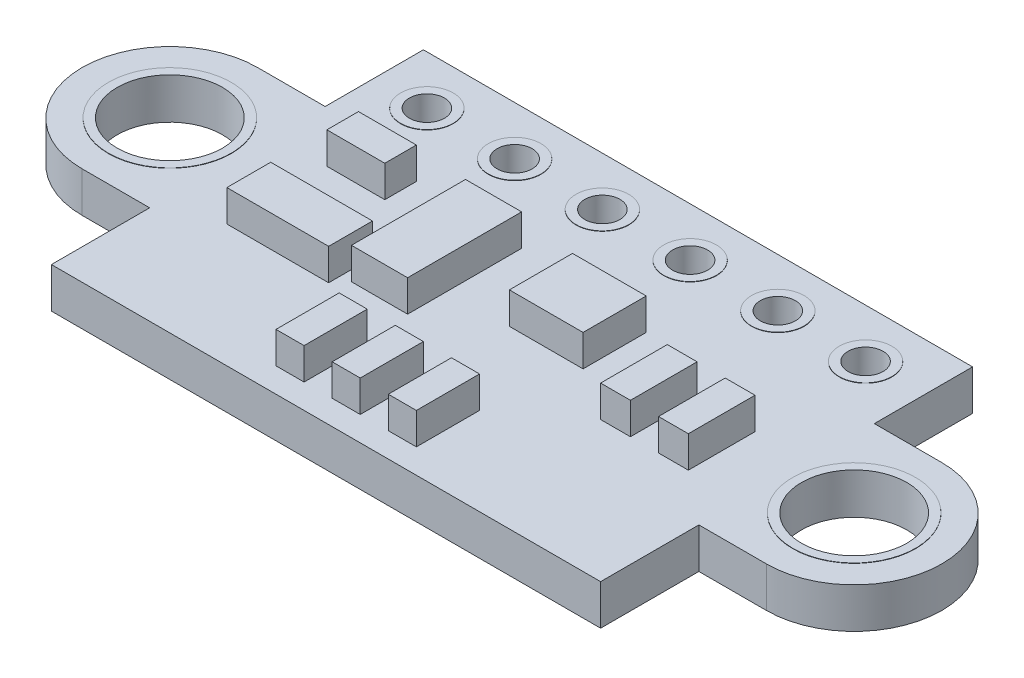
from build123d import *

# Parameters (mm, degrees)
SKETCH1_R               = 1.5
PCB_DEPTH               = 1.15
SKETCH2_R               = 0.5
INITIAL_HOLE_DEPTH      = 14.396828237
PIN_HOLE_LPATTERN_COUNT = 6
PIN_HOLE_LPATTERN_PITCH = 2.5
SKETCH4_W               = 4.4
SKETCH4_H               = 2.4
BOTTOM_COMPONENT_DEPTH  = 0.7
SKETCH3_W               = 0.8
SKETCH3_H               = 1.8
SKETCH3_W_2             = 1.65
SKETCH3_H_2             = 0.9
TAN_COMPONENTS_DEPTH    = 0.9
SKETCH3_3_W             = 2.1
SKETCH3_3_H             = 1.8
SKETCH3_3_W_2           = 1.6
SKETCH3_3_H_2           = 3.25
SKETCH3_3_W_3           = 2.9
SKETCH3_3_H_3           = 1.25
SKETCH3_3_W_4           = 0.85
SKETCH3_3_H_4           = 1.9
BLACK_COMPONENTS_DEPTH  = 0.9
GOLD_START              = -1.16
SKETCH5_R               = 0.75
SKETCH5_R_2             = 0.5
SKETCH5_R_3             = 1.75
SKETCH5_R_4             = 1.5
GOLD_CONTACTS_DEPTH     = 1.17
SILKSCREEN_DEPTH        = 0.01


with BuildPart() as part:
    # Sketch1 → PCB (new body)
    with BuildSketch(Plane(origin=(0, 0, 0), x_dir=(1, 0, 0), z_dir=(0, 1, 0))):
        with BuildLine():
            Line((-7.825, -5.299999814), (7.825, -5.299999814))
            Line((7.825, -5.299999814), (7.825, -2.499999814))
            Line((7.825, -2.499999814), (9.750000197, -2.499999814))
            ThreePointArc((9.750000197, -2.499999814), (12.250000197, 1.86e-07), (9.750000197, 2.500000186))
            Line((9.750000197, 2.500000186), (7.825, 2.500000186))
            Line((7.825, 2.500000186), (7.825, 5.300000186))
            Line((7.825, 5.300000186), (-7.825, 5.300000186))
            Line((-7.825, 5.300000186), (-7.825, 2.500000186))
            Line((-7.825, 2.500000186), (-9.750000197, 2.5))
            ThreePointArc((-9.750000197, 2.5), (-12.249999803, 0), (-9.750000197, -2.5))
            Line((-9.750000197, -2.5), (-7.825, -2.499999814))
            Line((-7.825, -2.499999814), (-7.825, -5.299999814))
        make_face()
        with Locations(Location((-9.749999803, 0, 0), (0, 0, 270))):
            Circle(SKETCH1_R, mode=Mode.SUBTRACT)
        with Locations(Location((9.750000197, 1.86e-07, 0), (0, 0, 270))):
            Circle(SKETCH1_R, mode=Mode.SUBTRACT)
    extrude(amount=PCB_DEPTH)

    # Sketch2 → Initial Hole (cut, through all)
    with BuildSketch(Plane(origin=(0, 1.15, 0), x_dir=(1, 0, 0), z_dir=(0, 1, 0))):
        with Locations(Location((-6.325, 3.900000186, 0), (0, 0, 270))):
            Circle(SKETCH2_R)
    initial_hole = extrude(amount=-INITIAL_HOLE_DEPTH, mode=Mode.SUBTRACT)

    # Pin Hole LPattern: Initial Hole ×6
    with Locations(*[(i * PIN_HOLE_LPATTERN_PITCH, 0, 0) for i in range(1, PIN_HOLE_LPATTERN_COUNT)]):
        add(initial_hole, mode=Mode.SUBTRACT)

    # Sketch4 → Bottom Component (add)
    with BuildSketch(Plane.XZ):
        with Locations((-0.125, 2.499999814)):
            Rectangle(SKETCH4_W, SKETCH4_H)
    extrude(amount=BOTTOM_COMPONENT_DEPTH)

    # Sketch3 → Tan Components (add)
    with BuildSketch(Plane(origin=(0, 1.15, 0), x_dir=(1, 0, 0), z_dir=(0, 1, 0))):
        with Locations((-1.725, -3.699999814)):
            Rectangle(SKETCH3_W, SKETCH3_H)
        with Locations((-0.125, -3.699999814)):
            Rectangle(SKETCH3_W, SKETCH3_H)
        with Locations((1.475, -3.699999814)):
            Rectangle(SKETCH3_W, SKETCH3_H)
        with Locations((-5.5, 1.500000186)):
            Rectangle(SKETCH3_W_2, SKETCH3_H_2)
    extrude(amount=TAN_COMPONENTS_DEPTH)

    # Sketch3<3> → Black Components (add)
    with BuildSketch(Plane(origin=(0, 1.15, 0), x_dir=(1, 0, 0), z_dir=(0, 1, 0))):
        with Locations((1.275, 0.600000186)):
            Rectangle(SKETCH3_3_W, SKETCH3_3_H)
        with Locations((-2.325, 0.175000186)):
            Rectangle(SKETCH3_3_W_2, SKETCH3_3_H_2)
        with Locations((-4.875, -1.174999814)):
            Rectangle(SKETCH3_3_W_3, SKETCH3_3_H_3)
        with Locations((4.25, -0.349999814)):
            Rectangle(SKETCH3_3_W_4, SKETCH3_3_H_4)
        with Locations((5.9, -0.349999814)):
            Rectangle(SKETCH3_3_W_4, SKETCH3_3_H_4)
    extrude(amount=BLACK_COMPONENTS_DEPTH)

    # Sketch5 → Gold Contacts (add)
    # profile 1 of 8: a face of its own
    with BuildSketch(Plane(origin=(0, 1.15, 0), x_dir=(1, 0, 0), z_dir=(0, 1, 0)).offset(GOLD_START)):
        with Locations(Location((-6.325, 3.9, 0), (0, 0, 90))):
            Circle(SKETCH5_R)
        with Locations(Location((-6.325, 3.9, 0), (0, 0, 270))):
            Circle(SKETCH5_R_2, mode=Mode.SUBTRACT)
    # profile 2 of 8: a face of its own
    with BuildSketch(Plane(origin=(0, 1.15, 0), x_dir=(1, 0, 0), z_dir=(0, 1, 0)).offset(GOLD_START)):
        with Locations(Location((-3.825, 3.9, 0), (0, 0, 90))):
            Circle(SKETCH5_R)
        with Locations(Location((-3.825, 3.9, 0), (0, 0, 270))):
            Circle(SKETCH5_R_2, mode=Mode.SUBTRACT)
    # profile 3 of 8: a face of its own
    with BuildSketch(Plane(origin=(0, 1.15, 0), x_dir=(1, 0, 0), z_dir=(0, 1, 0)).offset(GOLD_START)):
        with Locations(Location((-1.325, 3.9, 0), (0, 0, 90))):
            Circle(SKETCH5_R)
        with Locations(Location((-1.325, 3.9, 0), (0, 0, 270))):
            Circle(SKETCH5_R_2, mode=Mode.SUBTRACT)
    # profile 4 of 8: a face of its own
    with BuildSketch(Plane(origin=(0, 1.15, 0), x_dir=(1, 0, 0), z_dir=(0, 1, 0)).offset(GOLD_START)):
        with Locations(Location((1.175, 3.9, 0), (0, 0, 90))):
            Circle(SKETCH5_R)
        with Locations(Location((1.175, 3.9, 0), (0, 0, 270))):
            Circle(SKETCH5_R_2, mode=Mode.SUBTRACT)
    # profile 5 of 8: a face of its own
    with BuildSketch(Plane(origin=(0, 1.15, 0), x_dir=(1, 0, 0), z_dir=(0, 1, 0)).offset(GOLD_START)):
        with Locations(Location((3.675, 3.9, 0), (0, 0, 90))):
            Circle(SKETCH5_R)
        with Locations(Location((3.675, 3.9, 0), (0, 0, 270))):
            Circle(SKETCH5_R_2, mode=Mode.SUBTRACT)
    # profile 6 of 8: a face of its own
    with BuildSketch(Plane(origin=(0, 1.15, 0), x_dir=(1, 0, 0), z_dir=(0, 1, 0)).offset(GOLD_START)):
        with Locations(Location((6.175, 3.9, 0), (0, 0, 90))):
            Circle(SKETCH5_R)
        with Locations(Location((6.175, 3.9, 0), (0, 0, 270))):
            Circle(SKETCH5_R_2, mode=Mode.SUBTRACT)
    # profile 7 of 8: a face of its own
    with BuildSketch(Plane(origin=(0, 1.15, 0), x_dir=(1, 0, 0), z_dir=(0, 1, 0)).offset(GOLD_START)):
        with Locations(Location((-9.749999803, 0, 0), (0, 0, 90))):
            Circle(SKETCH5_R_3)
        with Locations(Location((-9.749999803, 0, 0), (0, 0, 90))):
            Circle(SKETCH5_R_4, mode=Mode.SUBTRACT)
    # profile 8 of 8: a face of its own
    with BuildSketch(Plane(origin=(0, 1.15, 0), x_dir=(1, 0, 0), z_dir=(0, 1, 0)).offset(GOLD_START)):
        with Locations(Location((9.750000197, 1.86e-07, 0), (0, 0, 90))):
            Circle(SKETCH5_R_3)
        with Locations(Location((9.750000197, 1.86e-07, 0), (0, 0, 90))):
            Circle(SKETCH5_R_4, mode=Mode.SUBTRACT)
    extrude(amount=GOLD_CONTACTS_DEPTH)

    # Sketch6 → Silkscreen (add)
    # profile 1 of 22: a face of its own
    with BuildSketch(Plane.XZ):
        Polygon((-6.825, -1.952173913), (-5.825, -2.287771739), (-5.825, -2.471195652), (-6.825, -2.807246377), (-6.825, -2.653713768), (-6.151086957, -2.43451087), (-5.953623188, -2.372463768), (-6.151086957, -2.310643116), (-6.825, -2.097327899), align=None)
    # profile 2 of 22: a face of its own
    with BuildSketch(Plane.XZ):
        Polygon((-6.709057971, -1.582608696), (-6.709057971, -1.814492754), (-6.825, -1.814492754), (-6.825, -1.205797101), (-6.709057971, -1.205797101), (-6.709057971, -1.437681159), (-5.940942029, -1.437681159), (-5.940942029, -1.205797101), (-5.825, -1.205797101), (-5.825, -1.814492754), (-5.940942029, -1.814492754), (-5.940942029, -1.582608696), align=None)
    # profile 3 of 22: a face of its own
    with BuildSketch(Plane.XZ):
        Polygon((-5.825, -0.32173913), (-5.825, -0.513088768), (-6.450226449, -0.780751812), (-6.651086957, -0.857971014), (-6.145652174, -0.857971014), (-5.825, -0.857971014), (-5.825, -1.002898551), (-6.825, -1.002898551), (-6.825, -0.813813406), (-6.229438406, -0.558831522), (-5.998913043, -0.466666667), (-6.538768116, -0.466666667), (-6.825, -0.466666667), (-6.825, -0.32173913), align=None)
    # profile 4 of 22: a face of its own
    with BuildSketch(Plane.XZ):
        with BuildLine():
            add(Edge.make_bspline(
                [(-4.16557971, -2.017391304), (-4.174136808, -2.036630775), (-4.191199813, -2.074994622), (-4.206514485, -2.125407709), (-4.215359186, -2.166891843), (-4.220047282, -2.199419822), (-4.223108769, -2.233289439), (-4.22340197, -2.25636393), (-4.223550725, -2.268070652)],
                knots=[0, 0, 0, 0, 1.45945927, 2.910187841, 3.643322816, 4.400006487, 5.188251666, 6, 6, 6, 6], degree=3))
            add(Edge.make_bspline(
                [(-4.223550725, -2.268070652), (-4.22322949, -2.281377316), (-4.222602438, -2.307351996), (-4.216940861, -2.345108655), (-4.208337016, -2.380758222), (-4.195489198, -2.413866615), (-4.17961186, -2.44462082), (-4.160629453, -2.472899107), (-4.138904749, -2.498868644), (-4.113944215, -2.522077592), (-4.086253856, -2.542779138), (-4.055632763, -2.560551871), (-4.022719242, -2.576378917), (-3.987082881, -2.589094015), (-3.949265216, -2.599443979), (-3.909263191, -2.606099476), (-3.867467195, -2.611013366), (-3.838904478, -2.611397876), (-3.824320652, -2.611594203)],
                knots=[0, 0, 0, 0, 1.073506903, 2.095491357, 3.07528147, 4.02808022, 4.954664346, 5.863855779, 6.771964439, 7.68156413, 8.60894928, 9.556766833, 10.535210833, 11.552936014, 12.60679191, 13.695699548, 14.823448183, 16, 16, 16, 16], degree=3))
            add(Edge.make_bspline(
                [(-3.824320652, -2.611594203), (-3.809143177, -2.611380344), (-3.779578644, -2.610963765), (-3.736449664, -2.607633153), (-3.695878247, -2.601633568), (-3.657629955, -2.593961819), (-3.622081106, -2.583343084), (-3.589249985, -2.570170376), (-3.55912608, -2.554625403), (-3.531963675, -2.536090261), (-3.507539876, -2.515047996), (-3.486319521, -2.490985639), (-3.468092374, -2.464275607), (-3.452820225, -2.434812166), (-3.44069766, -2.402464295), (-3.432593727, -2.36704555), (-3.427130416, -2.328777955), (-3.426681667, -2.302209832), (-3.426449275, -2.288451087)],
                knots=[0, 0, 0, 0, 1.243083075, 2.421428388, 3.539723701, 4.600698439, 5.613925084, 6.573719655, 7.494592113, 8.384583086, 9.261071518, 10.128265192, 11.004557353, 11.903267233, 12.840351451, 13.825576228, 14.873938418, 16, 16, 16, 16], degree=3))
            add(Edge.make_bspline(
                [(-3.426449275, -2.288451087), (-3.426557797, -2.283391816), (-3.426783167, -2.272885048), (-3.427977385, -2.256723311), (-3.429688391, -2.240016095), (-3.432332267, -2.223210614), (-3.434998211, -2.206580775), (-3.439049004, -2.190736952), (-3.442817527, -2.175890096), (-3.446156732, -2.1666755), (-3.447735507, -2.162318841)],
                knots=[0, 0, 0, 0, 0.945174182, 1.962876632, 3.026435683, 4.081359978, 5.140798144, 6.170252855, 7.134895744, 8, 8, 8, 8], degree=3))
            Line((-3.447735507, -2.162318841), (-3.774275362, -2.162318841))
            Line((-3.774275362, -2.162318841), (-3.774275362, -2.363405797))
            Line((-3.774275362, -2.363405797), (-3.890217391, -2.363405797))
            Line((-3.890217391, -2.363405797), (-3.890217391, -2.017391304))
            Line((-3.890217391, -2.017391304), (-3.371875, -2.017391304))
            add(Edge.make_bspline(
                [(-3.371875, -2.017391304), (-3.367030046, -2.028271125), (-3.357200328, -2.050344726), (-3.345363234, -2.08510047), (-3.334241057, -2.120769039), (-3.325959411, -2.157567213), (-3.31869163, -2.19443818), (-3.31419718, -2.231229109), (-3.310988457, -2.267183443), (-3.310665771, -2.290859659), (-3.310507246, -2.302490942)],
                knots=[0, 0, 0, 0, 0.972500234, 1.973063936, 2.997292887, 4.023432248, 5.052698482, 6.066196364, 7.049990992, 8, 8, 8, 8], degree=3))
            add(Edge.make_bspline(
                [(-3.310507246, -2.302490942), (-3.310905816, -2.319565756), (-3.311684267, -2.35291475), (-3.317554741, -2.401697579), (-3.327799519, -2.447761658), (-3.341765997, -2.491305823), (-3.359867574, -2.531840385), (-3.381832828, -2.569470393), (-3.407650288, -2.603973416), (-3.437529203, -2.635228568), (-3.471387186, -2.662948247), (-3.508911649, -2.687650368), (-3.550729527, -2.708302897), (-3.596038452, -2.726063283), (-3.645257849, -2.739888456), (-3.698190574, -2.749395276), (-3.754813701, -2.755404218), (-3.793809632, -2.756141713), (-3.813903986, -2.756521739)],
                knots=[0, 0, 0, 0, 1.063581333, 2.077291621, 3.055048503, 3.999338437, 4.921305722, 5.814907333, 6.708360461, 7.599707407, 8.501634143, 9.428958272, 10.392121034, 11.401590661, 12.45703254, 13.571190175, 14.748449862, 16, 16, 16, 16], degree=3))
            add(Edge.make_bspline(
                [(-3.813903986, -2.756521739), (-3.833924869, -2.756086904), (-3.873021503, -2.75523776), (-3.930089405, -2.748620154), (-3.983972025, -2.737560692), (-4.034559078, -2.722216618), (-4.081689195, -2.702747531), (-4.124974269, -2.679239878), (-4.165055349, -2.652836335), (-4.200910799, -2.622257515), (-4.232998202, -2.588436343), (-4.261036494, -2.551292568), (-4.284869344, -2.510889075), (-4.304888067, -2.467540256), (-4.320451722, -2.421293126), (-4.331540229, -2.372516514), (-4.338177251, -2.321469625), (-4.339049616, -2.286659206), (-4.339492754, -2.268976449)],
                knots=[0, 0, 0, 0, 1.187439749, 2.318823544, 3.40248674, 4.446409754, 5.450107936, 6.421783, 7.364382464, 8.292037633, 9.210592067, 10.124945974, 11.046464198, 11.988116631, 12.952407463, 13.935437336, 14.951257712, 16, 16, 16, 16], degree=3))
            add(Edge.make_bspline(
                [(-4.339492754, -2.268976449), (-4.338967559, -2.246458731), (-4.337940426, -2.202420402), (-4.331256424, -2.14819149), (-4.323600483, -2.106385649), (-4.315620928, -2.076129681), (-4.307099293, -2.0462542), (-4.299706484, -2.027004609), (-4.296014493, -2.017391304)],
                knots=[0, 0, 0, 0, 1.577988587, 3.086102288, 3.823904134, 4.555361188, 5.278542922, 6, 6, 6, 6], degree=3))
            Line((-4.296014493, -2.017391304), (-4.16557971, -2.017391304))
        make_face()
    # profile 5 of 22: a face of its own
    with BuildSketch(Plane.XZ):
        Polygon((-3.325, -1.176811594), (-3.325, -1.368161232), (-3.950226449, -1.635824275), (-4.151086957, -1.713043478), (-3.645652174, -1.713043478), (-3.325, -1.713043478), (-3.325, -1.857971014), (-4.325, -1.857971014), (-4.325, -1.66888587), (-3.729438406, -1.413903986), (-3.498913043, -1.32173913), (-4.038768116, -1.32173913), (-4.325, -1.32173913), (-4.325, -1.176811594), align=None)
    # profile 6 of 22: a face of its own
    with BuildSketch(Plane.XZ):
        with BuildLine():
            add(Edge.make_bspline(
                [(-3.836096014, -0.27826087), (-3.812594171, -0.278737134), (-3.766491769, -0.279671398), (-3.709766433, -0.286970746), (-3.666180263, -0.295280938), (-3.634972547, -0.303483854), (-3.604849033, -0.313234061), (-3.575958638, -0.324751193), (-3.548183732, -0.337951756), (-3.52159763, -0.352747386), (-3.496713015, -0.369994169), (-3.472761853, -0.388505681), (-3.450235426, -0.409094524), (-3.429589218, -0.432168545), (-3.410505814, -0.457341518), (-3.393246465, -0.48485945), (-3.377997913, -0.514659864), (-3.363881117, -0.546402566), (-3.352650459, -0.580813238), (-3.342514641, -0.617323563), (-3.33463535, -0.656364207), (-3.329042087, -0.697964541), (-3.325608517, -0.742121998), (-3.325206339, -0.772442291), (-3.325, -0.787998188)],
                knots=[0, 0, 0, 0, 1.874778086, 3.677659276, 4.555411841, 5.414508245, 6.25076779, 7.080755626, 7.894473888, 8.703653385, 9.505626019, 10.308141413, 11.118150068, 11.937068997, 12.775581797, 13.636302782, 14.525391725, 15.445290438, 16.405354875, 17.410742648, 18.46805968, 19.580643525, 20.758743499, 22, 22, 22, 22], degree=3))
            Line((-3.325, -0.787998188), (-3.325, -1.002898551))
            Line((-3.325, -1.002898551), (-4.325, -1.002898551))
            Line((-4.325, -1.002898551), (-4.325, -0.744293478))
            add(Edge.make_bspline(
                [(-4.325, -0.744293478), (-4.324688368, -0.725333018), (-4.324083472, -0.688529625), (-4.318395518, -0.635197923), (-4.30890193, -0.585590009), (-4.295955445, -0.539604937), (-4.278839084, -0.497440889), (-4.258296007, -0.45883863), (-4.233600376, -0.424093617), (-4.205072566, -0.393057329), (-4.172712538, -0.365663685), (-4.136222346, -0.342239325), (-4.095907101, -0.322258215), (-4.051566132, -0.305974266), (-4.003189722, -0.293682427), (-3.951029965, -0.284699007), (-3.894863296, -0.279213265), (-3.856111855, -0.278585251), (-3.836096014, -0.27826087)],
                knots=[0, 0, 0, 0, 1.17177347, 2.274482801, 3.310388109, 4.291013938, 5.222472681, 6.118087065, 6.988127256, 7.850034114, 8.717518086, 9.601485366, 10.523818561, 11.493740021, 12.515690363, 13.604990885, 14.762933224, 16, 16, 16, 16], degree=3))
        make_face()
        with BuildLine():
            add(Edge.make_bspline(
                [(-3.824547101, -0.423188406), (-3.841612899, -0.423371822), (-3.874427817, -0.423724502), (-3.921550288, -0.427329088), (-3.964611557, -0.43335622), (-4.003740235, -0.441819199), (-4.039012488, -0.452994776), (-4.070937402, -0.466111822), (-4.09887287, -0.482673258), (-4.123789391, -0.50122703), (-4.144883235, -0.522800987), (-4.163203552, -0.546604149), (-4.177741542, -0.573323206), (-4.18966826, -0.60231497), (-4.198346963, -0.633909563), (-4.204715068, -0.667986445), (-4.208204125, -0.704743636), (-4.208767587, -0.730095831), (-4.209057971, -0.743161232)],
                knots=[0, 0, 0, 0, 1.413273786, 2.717509377, 3.911113665, 5.012370192, 6.028682814, 6.972739505, 7.863782455, 8.711554031, 9.53824734, 10.354760011, 11.191533455, 12.049501983, 12.946054968, 13.900037449, 14.917772052, 16, 16, 16, 16], degree=3))
            Line((-4.209057971, -0.743161232), (-4.209057971, -0.857971014))
            Line((-4.209057971, -0.857971014), (-3.440942029, -0.857971014))
            Line((-3.440942029, -0.857971014), (-3.440942029, -0.758106884))
            add(Edge.make_bspline(
                [(-3.440942029, -0.758106884), (-3.441280588, -0.744586824), (-3.441938681, -0.718306405), (-3.446036804, -0.68011771), (-3.453866258, -0.644687488), (-3.464227658, -0.611790195), (-3.47752298, -0.581425169), (-3.494259025, -0.553832382), (-3.513777188, -0.528726818), (-3.536487171, -0.5063141), (-3.562196806, -0.486545875), (-3.591014635, -0.469554942), (-3.622633627, -0.455009878), (-3.657253549, -0.443271608), (-3.694873433, -0.434308497), (-3.735437992, -0.427783479), (-3.779033431, -0.423973079), (-3.809065455, -0.423455315), (-3.824547101, -0.423188406)],
                knots=[0, 0, 0, 0, 1.112368836, 2.162232858, 3.153671654, 4.092370021, 4.995862172, 5.873374016, 6.740409183, 7.605418486, 8.490978658, 9.401506614, 10.351738463, 11.349303293, 12.403565438, 13.529577563, 14.726485918, 16, 16, 16, 16], degree=3))
        make_face(mode=Mode.SUBTRACT)
    # profile 7 of 22: a face of its own
    with BuildSketch(Plane.XZ):
        with BuildLine():
            add(Edge.make_bspline(
                [(-1.095606884, -2.031884058), (-1.084037243, -2.032217236), (-1.061517869, -2.032865741), (-1.02883408, -2.038329271), (-0.998514455, -2.04769559), (-0.970339585, -2.060464718), (-0.944570102, -2.076602975), (-0.920890583, -2.095645384), (-0.899597744, -2.117634909), (-0.880775705, -2.142642667), (-0.863875018, -2.170070441), (-0.84972659, -2.200494312), (-0.837484548, -2.233341893), (-0.827584942, -2.268731992), (-0.82003006, -2.306373014), (-0.814277248, -2.345969656), (-0.811208625, -2.387511393), (-0.810744152, -2.415786545), (-0.810507246, -2.430208333)],
                knots=[0, 0, 0, 0, 1.005542668, 1.957207907, 2.870649987, 3.757654935, 4.639106304, 5.50728757, 6.393806754, 7.292990278, 8.223879093, 9.189763998, 10.205281347, 11.269088171, 12.381198635, 13.541420952, 14.745997712, 16, 16, 16, 16], degree=3))
            add(Edge.make_bspline(
                [(-0.810507246, -2.430208333), (-0.810622933, -2.443496977), (-0.810853786, -2.470014301), (-0.813166181, -2.509408285), (-0.815673861, -2.548009533), (-0.819456641, -2.585126407), (-0.823303967, -2.620585883), (-0.828456035, -2.653751594), (-0.833398889, -2.684469288), (-0.837531778, -2.703848445), (-0.839492754, -2.713043478)],
                knots=[0, 0, 0, 0, 1.119774364, 2.234495903, 3.324975685, 4.379535058, 5.378502437, 6.330339078, 7.20777842, 8, 8, 8, 8], degree=3))
            Line((-0.839492754, -2.713043478), (-0.969927536, -2.713043478))
            add(Edge.make_bspline(
                [(-0.969927536, -2.713043478), (-0.966552908, -2.703194299), (-0.959657693, -2.683069944), (-0.951570232, -2.651503019), (-0.943974855, -2.618390348), (-0.937629391, -2.583417285), (-0.9326352, -2.546243106), (-0.929122846, -2.50672598), (-0.926744308, -2.464733157), (-0.926549451, -2.435948546), (-0.926449275, -2.421150362)],
                knots=[0, 0, 0, 0, 0.842364813, 1.72116351, 2.635659137, 3.591954833, 4.596841017, 5.670471508, 6.802388115, 8, 8, 8, 8], degree=3))
            add(Edge.make_bspline(
                [(-0.926449275, -2.421150362), (-0.92655811, -2.410577772), (-0.92676745, -2.390241856), (-0.928956044, -2.360938837), (-0.931809416, -2.334030456), (-0.936765492, -2.309574695), (-0.942469956, -2.28732606), (-0.949729155, -2.267216224), (-0.958367794, -2.249276352), (-0.968052863, -2.233195397), (-0.97924044, -2.219408765), (-0.991306366, -2.207338701), (-1.004787784, -2.197552637), (-1.019410561, -2.189872313), (-1.03498124, -2.183872496), (-1.051666285, -2.179898308), (-1.069411035, -2.177339563), (-1.08163324, -2.176990691), (-1.087907609, -2.176811594)],
                knots=[0, 0, 0, 0, 1.523249472, 2.929903915, 4.233296251, 5.419431577, 6.522341058, 7.540917397, 8.494515215, 9.388156094, 10.239274487, 11.04695073, 11.841108735, 12.62943441, 13.421354294, 14.239221521, 15.096090076, 16, 16, 16, 16], degree=3))
            add(Edge.make_bspline(
                [(-1.087907609, -2.176811594), (-1.094426537, -2.17703645), (-1.107163151, -2.177475772), (-1.125435736, -2.181963136), (-1.142380665, -2.188979105), (-1.15749305, -2.199264852), (-1.171692263, -2.211352456), (-1.184703873, -2.225552355), (-1.197283356, -2.241228157), (-1.213115965, -2.265007733), (-1.231630292, -2.298354985), (-1.250637426, -2.342511497), (-1.26886559, -2.38970772), (-1.288476693, -2.437864455), (-1.309006891, -2.486204671), (-1.331340416, -2.533292462), (-1.355979832, -2.578017492), (-1.381319557, -2.61105989), (-1.403463962, -2.634677033), (-1.421459789, -2.650462776), (-1.44109508, -2.664186822), (-1.461836158, -2.676643308), (-1.484550157, -2.686519849), (-1.509153672, -2.693424444), (-1.53573621, -2.697919666), (-1.554147254, -2.698335482), (-1.563677536, -2.698550725)],
                knots=[0, 0, 0, 0, 0.619856703, 1.211069627, 1.781317632, 2.357652662, 2.944124569, 3.554568585, 4.189016027, 4.857081954, 6.273378886, 7.815244584, 9.432151164, 11.09313998, 12.767999346, 14.433898664, 16.057028127, 17.6216601, 18.384562662, 19.138741378, 19.896851429, 20.66387654, 21.439947467, 22.247841025, 23.093013471, 24, 24, 24, 24], degree=3))
            add(Edge.make_bspline(
                [(-1.563677536, -2.698550725), (-1.572223552, -2.698290907), (-1.589336579, -2.697770634), (-1.614907555, -2.693472972), (-1.640254816, -2.686713531), (-1.665287559, -2.677198511), (-1.689421117, -2.664730656), (-1.712573795, -2.649573358), (-1.733868511, -2.630857975), (-1.7541838, -2.60963982), (-1.772586237, -2.58489951), (-1.789061309, -2.557014122), (-1.803511537, -2.525836375), (-1.816546422, -2.491668648), (-1.82691831, -2.453932463), (-1.83434214, -2.412792808), (-1.838533807, -2.368248169), (-1.839165775, -2.337448397), (-1.839492754, -2.321512681)],
                knots=[0, 0, 0, 0, 0.784008501, 1.569943279, 2.373275585, 3.189059721, 4.022597455, 4.862331727, 5.722035901, 6.618905113, 7.554234865, 8.545209567, 9.586587379, 10.704826919, 11.898277364, 13.172984207, 14.537309982, 16, 16, 16, 16], degree=3))
            add(Edge.make_bspline(
                [(-1.839492754, -2.321512681), (-1.839317368, -2.312604062), (-1.838952995, -2.2940959), (-1.837368927, -2.265541429), (-1.834647801, -2.235792618), (-1.830979071, -2.205529197), (-1.826738506, -2.175318782), (-1.821753302, -2.14565927), (-1.816429126, -2.117187582), (-1.812435233, -2.098753719), (-1.810507246, -2.089855072)],
                knots=[0, 0, 0, 0, 0.914358742, 1.899632051, 2.934074914, 3.979452354, 5.027838988, 6.06445484, 7.065647236, 8, 8, 8, 8], degree=3))
            Line((-1.810507246, -2.089855072), (-1.694565217, -2.089855072))
            add(Edge.make_bspline(
                [(-1.694565217, -2.089855072), (-1.698925606, -2.109666509), (-1.707605604, -2.149104107), (-1.716805547, -2.208363865), (-1.722438512, -2.266677422), (-1.723184374, -2.30512101), (-1.723550725, -2.324003623)],
                knots=[0, 0, 0, 0, 1.029354975, 2.049083439, 3.041754323, 4, 4, 4, 4], degree=3))
            add(Edge.make_bspline(
                [(-1.723550725, -2.324003623), (-1.723405312, -2.333516863), (-1.723123445, -2.351957249), (-1.721390441, -2.37865386), (-1.718216986, -2.403372901), (-1.7139249, -2.426139484), (-1.70861338, -2.447016528), (-1.701865324, -2.465939781), (-1.693628433, -2.482804989), (-1.684373765, -2.497895917), (-1.673896999, -2.510991), (-1.662774558, -2.522502654), (-1.650680114, -2.532113634), (-1.637615824, -2.539871733), (-1.623755385, -2.545943065), (-1.609156755, -2.550658199), (-1.593572125, -2.553051309), (-1.582932509, -2.553429675), (-1.577490942, -2.553623188)],
                knots=[0, 0, 0, 0, 1.491437277, 2.890989782, 4.191431573, 5.395946596, 6.521058188, 7.565423013, 8.539223212, 9.458660202, 10.334655275, 11.163081303, 11.963306063, 12.748694206, 13.538083787, 14.331542868, 15.146677777, 16, 16, 16, 16], degree=3))
            add(Edge.make_bspline(
                [(-1.577490942, -2.553623188), (-1.570971784, -2.553399859), (-1.55823472, -2.552963522), (-1.5398974, -2.548438055), (-1.522919275, -2.541474541), (-1.507500113, -2.531386016), (-1.493419772, -2.519066768), (-1.479923473, -2.505133221), (-1.467231268, -2.489422296), (-1.451018729, -2.465673216), (-1.432444857, -2.432169319), (-1.413455089, -2.387874166), (-1.394889723, -2.340779741), (-1.375339262, -2.292569889), (-1.354853968, -2.244174305), (-1.335835518, -2.204717583), (-1.319501928, -2.17409803), (-1.30581027, -2.15264009), (-1.291370605, -2.132264668), (-1.275414854, -2.113533564), (-1.258550452, -2.095940414), (-1.240018277, -2.080309313), (-1.220378755, -2.066150977), (-1.199065245, -2.054076214), (-1.176151406, -2.043837011), (-1.151019267, -2.037035783), (-1.124001456, -2.032509701), (-1.10528886, -2.03209739), (-1.095606884, -2.031884058)],
                knots=[0, 0, 0, 0, 0.667490157, 1.304135379, 1.925338702, 2.541746512, 3.184203398, 3.84128389, 4.529338779, 5.253104542, 6.788775438, 8.449127214, 10.193159048, 11.981788067, 13.78535353, 15.582625783, 16.473069092, 17.343045967, 18.191816017, 19.032495598, 19.864754018, 20.688614347, 21.515778917, 22.344572585, 23.197569954, 24.082441501, 25.007847132, 26, 26, 26, 26], degree=3))
        make_face()
    # profile 8 of 22: a face of its own
    with BuildSketch(Plane.XZ):
        with BuildLine():
            add(Edge.make_bspline(
                [(-0.853985507, -1.191304348), (-0.847265054, -1.211198667), (-0.833858192, -1.250886523), (-0.820502545, -1.312589005), (-0.812044566, -1.375547052), (-0.811021461, -1.418103693), (-0.810507246, -1.439492754)],
                knots=[0, 0, 0, 0, 0.994474773, 1.983911717, 2.986709619, 4, 4, 4, 4], degree=3))
            add(Edge.make_bspline(
                [(-0.810507246, -1.439492754), (-0.810901207, -1.456417224), (-0.811668769, -1.489391568), (-0.81754297, -1.537334119), (-0.827551451, -1.582205593), (-0.841218668, -1.624256749), (-0.859507278, -1.663032142), (-0.881338394, -1.69901549), (-0.907309797, -1.731840445), (-0.937447752, -1.761377351), (-0.971279054, -1.787754026), (-1.009086081, -1.810543748), (-1.050637644, -1.829770601), (-1.096089466, -1.845247582), (-1.145099789, -1.857865696), (-1.19803705, -1.866127952), (-1.254690314, -1.871481194), (-1.293736763, -1.872129119), (-1.313903986, -1.872463768)],
                knots=[0, 0, 0, 0, 1.072461845, 2.089502642, 3.055154834, 3.982506854, 4.885653992, 5.766011576, 6.644638719, 7.530942326, 8.434292162, 9.357290509, 10.322575283, 11.330177533, 12.396475876, 13.525855063, 14.722121131, 16, 16, 16, 16], degree=3))
            add(Edge.make_bspline(
                [(-1.313903986, -1.872463768), (-1.333541802, -1.872046818), (-1.371919636, -1.87123198), (-1.428125246, -1.865615079), (-1.481386529, -1.85580605), (-1.531791789, -1.842681738), (-1.578680738, -1.825346283), (-1.622235705, -1.80504693), (-1.66199991, -1.781216428), (-1.698049149, -1.754188874), (-1.730184027, -1.723819803), (-1.758645531, -1.690500807), (-1.78297031, -1.653943996), (-1.803450326, -1.614674149), (-1.819634828, -1.57252485), (-1.83099783, -1.527831802), (-1.838351232, -1.480722439), (-1.839106398, -1.448503605), (-1.839492754, -1.432019928)],
                knots=[0, 0, 0, 0, 1.219583202, 2.383409664, 3.503355981, 4.580195591, 5.613927346, 6.60373989, 7.560461434, 8.487729334, 9.396383554, 10.300965463, 11.203297331, 12.117485303, 13.046422561, 14.000383661, 14.976963838, 16, 16, 16, 16], degree=3))
            add(Edge.make_bspline(
                [(-1.839492754, -1.432019928), (-1.839374098, -1.420768898), (-1.839140568, -1.398625381), (-1.836951594, -1.366079387), (-1.834002252, -1.334751992), (-1.827485834, -1.294938294), (-1.816584324, -1.246581538), (-1.802847935, -1.209667817), (-1.796014493, -1.191304348)],
                knots=[0, 0, 0, 0, 0.82263702, 1.61905864, 2.384719601, 3.122514214, 4.568537041, 6, 6, 6, 6], degree=3))
            Line((-1.796014493, -1.191304348), (-1.66557971, -1.191304348))
            add(Edge.make_bspline(
                [(-1.66557971, -1.191304348), (-1.67014263, -1.200234343), (-1.679184809, -1.217930601), (-1.690813612, -1.245400499), (-1.700619737, -1.273350942), (-1.709290954, -1.30182182), (-1.715450709, -1.33125284), (-1.720385378, -1.361755051), (-1.723022277, -1.39362752), (-1.723372729, -1.415333944), (-1.723550725, -1.426358696)],
                knots=[0, 0, 0, 0, 0.983555818, 1.94907818, 2.92339169, 3.888715259, 4.866203398, 5.870584672, 6.918464223, 8, 8, 8, 8], degree=3))
            add(Edge.make_bspline(
                [(-1.723550725, -1.426358696), (-1.723308335, -1.437630288), (-1.722833794, -1.459697356), (-1.71726705, -1.491923246), (-1.70910268, -1.522621867), (-1.697148519, -1.551521546), (-1.682298043, -1.578642811), (-1.663831601, -1.603366367), (-1.643035491, -1.626525261), (-1.618792522, -1.6471198), (-1.591687156, -1.665565159), (-1.561592242, -1.681523099), (-1.528948792, -1.695681528), (-1.493342612, -1.707118464), (-1.455147418, -1.716429231), (-1.414251783, -1.722892673), (-1.370817664, -1.726754837), (-1.341010647, -1.72727083), (-1.325679348, -1.727536232)],
                knots=[0, 0, 0, 0, 0.961321688, 1.882036724, 2.784158746, 3.668588788, 4.54556749, 5.416939704, 6.297416125, 7.197763834, 8.125489491, 9.091444601, 10.101847706, 11.159586289, 12.280336908, 13.455344771, 14.691151478, 16, 16, 16, 16], degree=3))
            add(Edge.make_bspline(
                [(-1.325679348, -1.727536232), (-1.309669946, -1.727349541), (-1.278663797, -1.72698797), (-1.233657513, -1.723338585), (-1.191687563, -1.717240514), (-1.152652909, -1.709016935), (-1.116693585, -1.698213284), (-1.083904011, -1.684773943), (-1.053977905, -1.669187417), (-1.027143609, -1.651040272), (-1.003308302, -1.630481199), (-0.982636226, -1.607615562), (-0.965216889, -1.582299822), (-0.950883725, -1.554884447), (-0.940055192, -1.525060397), (-0.932116639, -1.493200522), (-0.927296399, -1.459038371), (-0.926736851, -1.435508094), (-0.926449275, -1.423414855)],
                knots=[0, 0, 0, 0, 1.344764027, 2.604466577, 3.790065809, 4.905748876, 5.95291627, 6.939762846, 7.878684932, 8.782738285, 9.654914262, 10.51702678, 11.364887745, 12.22998046, 13.108770886, 14.023899159, 14.984395335, 16, 16, 16, 16], degree=3))
            add(Edge.make_bspline(
                [(-0.926449275, -1.423414855), (-0.926597601, -1.412990176), (-0.926891639, -1.392324569), (-0.930024622, -1.36170696), (-0.934638715, -1.331716693), (-0.941597766, -1.302433621), (-0.949991962, -1.273742021), (-0.959625863, -1.245518646), (-0.971293022, -1.218094173), (-0.980037468, -1.200248709), (-0.98442029, -1.191304348)],
                knots=[0, 0, 0, 0, 1.035533676, 2.052814528, 3.055360482, 4.048773743, 5.04096863, 6.025393086, 7.010303204, 8, 8, 8, 8], degree=3))
            Line((-0.98442029, -1.191304348), (-0.853985507, -1.191304348))
        make_face()
    # profile 9 of 22: a face of its own
    with BuildSketch(Plane.XZ):
        Polygon((-0.825, -0.336231884), (-0.825, -0.915942029), (-1.825, -0.915942029), (-1.825, -0.771014493), (-0.940942029, -0.771014493), (-0.940942029, -0.336231884), align=None)
    # profile 10 of 22: a face of its own
    with BuildSketch(Plane.XZ):
        with BuildLine():
            add(Edge.make_bspline(
                [(1.404393116, -2.031884058), (1.415962757, -2.032217236), (1.438482131, -2.032865741), (1.47116592, -2.038329271), (1.501485545, -2.04769559), (1.529660415, -2.060464718), (1.555429898, -2.076602975), (1.579109417, -2.095645384), (1.600402256, -2.117634909), (1.619224295, -2.142642667), (1.636124982, -2.170070441), (1.65027341, -2.200494312), (1.662515452, -2.233341893), (1.672415058, -2.268731992), (1.67996994, -2.306373014), (1.685722752, -2.345969656), (1.688791375, -2.387511393), (1.689255848, -2.415786545), (1.689492754, -2.430208333)],
                knots=[0, 0, 0, 0, 1.005542668, 1.957207907, 2.870649987, 3.757654935, 4.639106304, 5.50728757, 6.393806754, 7.292990278, 8.223879093, 9.189763998, 10.205281347, 11.269088171, 12.381198635, 13.541420952, 14.745997712, 16, 16, 16, 16], degree=3))
            add(Edge.make_bspline(
                [(1.689492754, -2.430208333), (1.689377067, -2.443496977), (1.689146214, -2.470014301), (1.686833819, -2.509408285), (1.684326139, -2.548009533), (1.680543359, -2.585126407), (1.676696033, -2.620585883), (1.671543965, -2.653751594), (1.666601111, -2.684469288), (1.662468222, -2.703848445), (1.660507246, -2.713043478)],
                knots=[0, 0, 0, 0, 1.119774364, 2.234495903, 3.324975685, 4.379535058, 5.378502437, 6.330339078, 7.20777842, 8, 8, 8, 8], degree=3))
            Line((1.660507246, -2.713043478), (1.530072464, -2.713043478))
            add(Edge.make_bspline(
                [(1.530072464, -2.713043478), (1.533447092, -2.703194299), (1.540342307, -2.683069944), (1.548429768, -2.651503019), (1.556025145, -2.618390348), (1.562370609, -2.583417285), (1.5673648, -2.546243106), (1.570877154, -2.50672598), (1.573255692, -2.464733157), (1.573450549, -2.435948546), (1.573550725, -2.421150362)],
                knots=[0, 0, 0, 0, 0.842364813, 1.72116351, 2.635659137, 3.591954833, 4.596841017, 5.670471508, 6.802388115, 8, 8, 8, 8], degree=3))
            add(Edge.make_bspline(
                [(1.573550725, -2.421150362), (1.57344189, -2.410577772), (1.57323255, -2.390241856), (1.571043956, -2.360938837), (1.568190584, -2.334030456), (1.563234508, -2.309574695), (1.557530044, -2.28732606), (1.550270845, -2.267216224), (1.541632206, -2.249276352), (1.531947137, -2.233195397), (1.52075956, -2.219408765), (1.508693634, -2.207338701), (1.495212216, -2.197552637), (1.480589439, -2.189872313), (1.46501876, -2.183872496), (1.448333715, -2.179898308), (1.430588965, -2.177339563), (1.41836676, -2.176990691), (1.412092391, -2.176811594)],
                knots=[0, 0, 0, 0, 1.523249472, 2.929903915, 4.233296251, 5.419431577, 6.522341058, 7.540917397, 8.494515215, 9.388156094, 10.239274487, 11.04695073, 11.841108735, 12.62943441, 13.421354294, 14.239221521, 15.096090076, 16, 16, 16, 16], degree=3))
            add(Edge.make_bspline(
                [(1.412092391, -2.176811594), (1.405573463, -2.17703645), (1.392836849, -2.177475772), (1.374564264, -2.181963136), (1.357619335, -2.188979105), (1.34250695, -2.199264852), (1.328307737, -2.211352456), (1.315296127, -2.225552355), (1.302716644, -2.241228157), (1.286884035, -2.265007733), (1.268369708, -2.298354985), (1.249362574, -2.342511497), (1.23113441, -2.38970772), (1.211523307, -2.437864455), (1.190993109, -2.486204671), (1.168659584, -2.533292462), (1.144020168, -2.578017492), (1.118680443, -2.61105989), (1.096536038, -2.634677033), (1.078540211, -2.650462776), (1.05890492, -2.664186822), (1.038163842, -2.676643308), (1.015449843, -2.686519849), (0.990846328, -2.693424444), (0.96426379, -2.697919666), (0.945852746, -2.698335482), (0.936322464, -2.698550725)],
                knots=[0, 0, 0, 0, 0.619856703, 1.211069627, 1.781317632, 2.357652662, 2.944124569, 3.554568585, 4.189016027, 4.857081954, 6.273378886, 7.815244584, 9.432151164, 11.09313998, 12.767999346, 14.433898664, 16.057028127, 17.6216601, 18.384562662, 19.138741378, 19.896851429, 20.66387654, 21.439947467, 22.247841025, 23.093013471, 24, 24, 24, 24], degree=3))
            add(Edge.make_bspline(
                [(0.936322464, -2.698550725), (0.927776448, -2.698290907), (0.910663421, -2.697770634), (0.885092445, -2.693472972), (0.859745184, -2.686713531), (0.834712441, -2.677198511), (0.810578883, -2.664730656), (0.787426205, -2.649573358), (0.766131489, -2.630857975), (0.7458162, -2.60963982), (0.727413763, -2.58489951), (0.710938691, -2.557014122), (0.696488463, -2.525836375), (0.683453578, -2.491668648), (0.67308169, -2.453932463), (0.66565786, -2.412792808), (0.661466193, -2.368248169), (0.660834225, -2.337448397), (0.660507246, -2.321512681)],
                knots=[0, 0, 0, 0, 0.784008501, 1.569943279, 2.373275585, 3.189059721, 4.022597455, 4.862331727, 5.722035901, 6.618905113, 7.554234865, 8.545209567, 9.586587379, 10.704826919, 11.898277364, 13.172984207, 14.537309982, 16, 16, 16, 16], degree=3))
            add(Edge.make_bspline(
                [(0.660507246, -2.321512681), (0.660682632, -2.312604062), (0.661047005, -2.2940959), (0.662631073, -2.265541429), (0.665352199, -2.235792618), (0.669020929, -2.205529197), (0.673261494, -2.175318782), (0.678246698, -2.14565927), (0.683570874, -2.117187582), (0.687564767, -2.098753719), (0.689492754, -2.089855072)],
                knots=[0, 0, 0, 0, 0.914358742, 1.899632051, 2.934074914, 3.979452354, 5.027838988, 6.06445484, 7.065647236, 8, 8, 8, 8], degree=3))
            Line((0.689492754, -2.089855072), (0.805434783, -2.089855072))
            add(Edge.make_bspline(
                [(0.805434783, -2.089855072), (0.801074394, -2.109666509), (0.792394396, -2.149104107), (0.783194453, -2.208363865), (0.777561488, -2.266677422), (0.776815626, -2.30512101), (0.776449275, -2.324003623)],
                knots=[0, 0, 0, 0, 1.029354975, 2.049083439, 3.041754323, 4, 4, 4, 4], degree=3))
            add(Edge.make_bspline(
                [(0.776449275, -2.324003623), (0.776594688, -2.333516863), (0.776876555, -2.351957249), (0.778609559, -2.37865386), (0.781783014, -2.403372901), (0.7860751, -2.426139484), (0.79138662, -2.447016528), (0.798134676, -2.465939781), (0.806371567, -2.482804989), (0.815626235, -2.497895917), (0.826103001, -2.510991), (0.837225442, -2.522502654), (0.849319886, -2.532113634), (0.862384176, -2.539871733), (0.876244615, -2.545943065), (0.890843245, -2.550658199), (0.906427875, -2.553051309), (0.917067491, -2.553429675), (0.922509058, -2.553623188)],
                knots=[0, 0, 0, 0, 1.491437277, 2.890989782, 4.191431573, 5.395946596, 6.521058188, 7.565423013, 8.539223212, 9.458660202, 10.334655275, 11.163081303, 11.963306063, 12.748694206, 13.538083787, 14.331542868, 15.146677777, 16, 16, 16, 16], degree=3))
            add(Edge.make_bspline(
                [(0.922509058, -2.553623188), (0.929028216, -2.553399859), (0.94176528, -2.552963522), (0.9601026, -2.548438055), (0.977080725, -2.541474541), (0.992499887, -2.531386016), (1.006580228, -2.519066768), (1.020076527, -2.505133221), (1.032768732, -2.489422296), (1.048981271, -2.465673216), (1.067555143, -2.432169319), (1.086544911, -2.387874166), (1.105110277, -2.340779741), (1.124660738, -2.292569889), (1.145146032, -2.244174305), (1.164164482, -2.204717583), (1.180498072, -2.17409803), (1.19418973, -2.15264009), (1.208629395, -2.132264668), (1.224585146, -2.113533564), (1.241449548, -2.095940414), (1.259981723, -2.080309313), (1.279621245, -2.066150977), (1.300934755, -2.054076214), (1.323848594, -2.043837011), (1.348980733, -2.037035783), (1.375998544, -2.032509701), (1.39471114, -2.03209739), (1.404393116, -2.031884058)],
                knots=[0, 0, 0, 0, 0.667490157, 1.304135379, 1.925338702, 2.541746512, 3.184203398, 3.84128389, 4.529338779, 5.253104542, 6.788775438, 8.449127214, 10.193159048, 11.981788067, 13.78535353, 15.582625783, 16.473069092, 17.343045967, 18.191816017, 19.032495598, 19.864754018, 20.688614347, 21.515778917, 22.344572585, 23.197569954, 24.082441501, 25.007847132, 26, 26, 26, 26], degree=3))
        make_face()
    # profile 11 of 22: a face of its own
    with BuildSketch(Plane.XZ):
        with BuildLine():
            add(Edge.make_bspline(
                [(1.163903986, -1.133333333), (1.187405829, -1.133809598), (1.233508231, -1.134743862), (1.290233567, -1.14204321), (1.333819737, -1.150353402), (1.365027453, -1.158556318), (1.395150967, -1.168306524), (1.424041362, -1.179823657), (1.451816268, -1.19302422), (1.47840237, -1.207819849), (1.503286985, -1.225066633), (1.527238147, -1.243578145), (1.549764574, -1.264166988), (1.570410782, -1.287241009), (1.589494186, -1.312413982), (1.606753535, -1.339931914), (1.622002087, -1.369732327), (1.636118883, -1.40147503), (1.647349541, -1.435885702), (1.657485359, -1.472396027), (1.66536465, -1.511436671), (1.670957913, -1.553037004), (1.674391483, -1.597194462), (1.674793661, -1.627514755), (1.675, -1.643070652)],
                knots=[0, 0, 0, 0, 1.874778086, 3.677659276, 4.555411841, 5.414508245, 6.25076779, 7.080755626, 7.894473888, 8.703653385, 9.505626019, 10.308141413, 11.118150068, 11.937068997, 12.775581797, 13.636302782, 14.525391725, 15.445290438, 16.405354875, 17.410742648, 18.46805968, 19.580643525, 20.758743499, 22, 22, 22, 22], degree=3))
            Line((1.675, -1.643070652), (1.675, -1.857971014))
            Line((1.675, -1.857971014), (0.675, -1.857971014))
            Line((0.675, -1.857971014), (0.675, -1.599365942))
            add(Edge.make_bspline(
                [(0.675, -1.599365942), (0.675311632, -1.580405482), (0.675916528, -1.543602089), (0.681604482, -1.490270387), (0.69109807, -1.440662473), (0.704044555, -1.394677401), (0.721160916, -1.352513353), (0.741703993, -1.313911094), (0.766399624, -1.279166081), (0.794927434, -1.248129793), (0.827287462, -1.220736148), (0.863777654, -1.197311789), (0.904092899, -1.177330678), (0.948433868, -1.16104673), (0.996810278, -1.148754891), (1.048970035, -1.139771471), (1.105136704, -1.134285729), (1.143888145, -1.133657715), (1.163903986, -1.133333333)],
                knots=[0, 0, 0, 0, 1.17177347, 2.274482801, 3.310388109, 4.291013938, 5.222472681, 6.118087065, 6.988127256, 7.850034114, 8.717518086, 9.601485366, 10.523818561, 11.493740021, 12.515690363, 13.604990885, 14.762933224, 16, 16, 16, 16], degree=3))
        make_face()
        with BuildLine():
            add(Edge.make_bspline(
                [(1.175452899, -1.27826087), (1.158387101, -1.278444285), (1.125572183, -1.278796966), (1.078449712, -1.282401552), (1.035388443, -1.288428684), (0.996259765, -1.296891663), (0.960987512, -1.30806724), (0.929062598, -1.321184286), (0.90112713, -1.337745722), (0.876210609, -1.356299493), (0.855116765, -1.377873451), (0.836796448, -1.401676613), (0.822258458, -1.42839567), (0.81033174, -1.457387434), (0.801653037, -1.488982027), (0.795284932, -1.523058908), (0.791795875, -1.5598161), (0.791232413, -1.585168294), (0.790942029, -1.598233696)],
                knots=[0, 0, 0, 0, 1.413273786, 2.717509377, 3.911113665, 5.012370192, 6.028682814, 6.972739505, 7.863782455, 8.711554031, 9.53824734, 10.354760011, 11.191533455, 12.049501983, 12.946054968, 13.900037449, 14.917772052, 16, 16, 16, 16], degree=3))
            Line((0.790942029, -1.598233696), (0.790942029, -1.713043478))
            Line((0.790942029, -1.713043478), (1.559057971, -1.713043478))
            Line((1.559057971, -1.713043478), (1.559057971, -1.613179348))
            add(Edge.make_bspline(
                [(1.559057971, -1.613179348), (1.558719412, -1.599659287), (1.558061319, -1.573378869), (1.553963196, -1.535190174), (1.546133742, -1.499759952), (1.535772342, -1.466862658), (1.52247702, -1.436497633), (1.505740975, -1.408904846), (1.486222812, -1.383799281), (1.463512829, -1.361386564), (1.437803194, -1.341618339), (1.408985365, -1.324627406), (1.377366373, -1.310082342), (1.342746451, -1.298344072), (1.305126567, -1.289380961), (1.264562008, -1.282855942), (1.220966569, -1.279045543), (1.190934545, -1.278527779), (1.175452899, -1.27826087)],
                knots=[0, 0, 0, 0, 1.112368836, 2.162232858, 3.153671654, 4.092370021, 4.995862172, 5.873374016, 6.740409183, 7.605418486, 8.490978658, 9.401506614, 10.351738463, 11.349303293, 12.403565438, 13.529577563, 14.726485918, 16, 16, 16, 16], degree=3))
        make_face(mode=Mode.SUBTRACT)
    # profile 12 of 22: a face of its own
    with BuildSketch(Plane.XZ):
        Polygon((1.675, -0.242028986), (1.675, -0.390353261), (1.457608696, -0.457155797), (1.457608696, -0.872463768), (1.675, -0.941304348), (1.675, -1.082608696), (0.675, -0.750181159), (0.675, -0.563813406), align=None)
        Polygon((1.341666667, -0.492934783), (0.791621377, -0.662318841), (1.341666667, -0.835778986), align=None, mode=Mode.SUBTRACT)
    # profile 13 of 22: a face of its own
    with BuildSketch(Plane.XZ):
        with BuildLine():
            add(Edge.make_bspline(
                [(3.33442029, -2.017391304), (3.325863192, -2.036630775), (3.308800187, -2.074994622), (3.293485515, -2.125407709), (3.284640814, -2.166891843), (3.279952718, -2.199419822), (3.276891231, -2.233289439), (3.27659803, -2.25636393), (3.276449275, -2.268070652)],
                knots=[0, 0, 0, 0, 1.45945927, 2.910187841, 3.643322816, 4.400006487, 5.188251666, 6, 6, 6, 6], degree=3))
            add(Edge.make_bspline(
                [(3.276449275, -2.268070652), (3.27677051, -2.281377316), (3.277397562, -2.307351996), (3.283059139, -2.345108655), (3.291662984, -2.380758222), (3.304510802, -2.413866615), (3.32038814, -2.44462082), (3.339370547, -2.472899107), (3.361095251, -2.498868644), (3.386055785, -2.522077592), (3.413746144, -2.542779138), (3.444367237, -2.560551871), (3.477280758, -2.576378917), (3.512917119, -2.589094015), (3.550734784, -2.599443979), (3.590736809, -2.606099476), (3.632532805, -2.611013366), (3.661095522, -2.611397876), (3.675679348, -2.611594203)],
                knots=[0, 0, 0, 0, 1.073506903, 2.095491357, 3.07528147, 4.02808022, 4.954664346, 5.863855779, 6.771964439, 7.68156413, 8.60894928, 9.556766833, 10.535210833, 11.552936014, 12.60679191, 13.695699548, 14.823448183, 16, 16, 16, 16], degree=3))
            add(Edge.make_bspline(
                [(3.675679348, -2.611594203), (3.690856823, -2.611380344), (3.720421356, -2.610963765), (3.763550336, -2.607633153), (3.804121753, -2.601633568), (3.842370045, -2.593961819), (3.877918894, -2.583343084), (3.910750015, -2.570170376), (3.94087392, -2.554625403), (3.968036325, -2.536090261), (3.992460124, -2.515047996), (4.013680479, -2.490985639), (4.031907626, -2.464275607), (4.047179775, -2.434812166), (4.05930234, -2.402464295), (4.067406273, -2.36704555), (4.072869584, -2.328777955), (4.073318333, -2.302209832), (4.073550725, -2.288451087)],
                knots=[0, 0, 0, 0, 1.243083075, 2.421428388, 3.539723701, 4.600698439, 5.613925084, 6.573719655, 7.494592113, 8.384583086, 9.261071518, 10.128265192, 11.004557353, 11.903267233, 12.840351451, 13.825576228, 14.873938418, 16, 16, 16, 16], degree=3))
            add(Edge.make_bspline(
                [(4.073550725, -2.288451087), (4.073442203, -2.283391816), (4.073216833, -2.272885048), (4.072022615, -2.256723311), (4.070311609, -2.240016095), (4.067667733, -2.223210614), (4.065001789, -2.206580775), (4.060950996, -2.190736952), (4.057182473, -2.175890096), (4.053843268, -2.1666755), (4.052264493, -2.162318841)],
                knots=[0, 0, 0, 0, 0.945174182, 1.962876632, 3.026435683, 4.081359978, 5.140798144, 6.170252855, 7.134895744, 8, 8, 8, 8], degree=3))
            Line((4.052264493, -2.162318841), (3.725724638, -2.162318841))
            Line((3.725724638, -2.162318841), (3.725724638, -2.363405797))
            Line((3.725724638, -2.363405797), (3.609782609, -2.363405797))
            Line((3.609782609, -2.363405797), (3.609782609, -2.017391304))
            Line((3.609782609, -2.017391304), (4.128125, -2.017391304))
            add(Edge.make_bspline(
                [(4.128125, -2.017391304), (4.132969954, -2.028271125), (4.142799672, -2.050344726), (4.154636766, -2.08510047), (4.165758943, -2.120769039), (4.174040589, -2.157567213), (4.18130837, -2.19443818), (4.18580282, -2.231229109), (4.189011543, -2.267183443), (4.189334229, -2.290859659), (4.189492754, -2.302490942)],
                knots=[0, 0, 0, 0, 0.972500234, 1.973063936, 2.997292887, 4.023432248, 5.052698482, 6.066196364, 7.049990992, 8, 8, 8, 8], degree=3))
            add(Edge.make_bspline(
                [(4.189492754, -2.302490942), (4.189094184, -2.319565756), (4.188315733, -2.35291475), (4.182445259, -2.401697579), (4.172200481, -2.447761658), (4.158234003, -2.491305823), (4.140132426, -2.531840385), (4.118167172, -2.569470393), (4.092349712, -2.603973416), (4.062470797, -2.635228568), (4.028612814, -2.662948247), (3.991088351, -2.687650368), (3.949270473, -2.708302897), (3.903961548, -2.726063283), (3.854742151, -2.739888456), (3.801809426, -2.749395276), (3.745186299, -2.755404218), (3.706190368, -2.756141713), (3.686096014, -2.756521739)],
                knots=[0, 0, 0, 0, 1.063581333, 2.077291621, 3.055048503, 3.999338437, 4.921305722, 5.814907333, 6.708360461, 7.599707407, 8.501634143, 9.428958272, 10.392121034, 11.401590661, 12.45703254, 13.571190175, 14.748449862, 16, 16, 16, 16], degree=3))
            add(Edge.make_bspline(
                [(3.686096014, -2.756521739), (3.666075131, -2.756086904), (3.626978497, -2.75523776), (3.569910595, -2.748620154), (3.516027975, -2.737560692), (3.465440922, -2.722216618), (3.418310805, -2.702747531), (3.375025731, -2.679239878), (3.334944651, -2.652836335), (3.299089201, -2.622257515), (3.267001798, -2.588436343), (3.238963506, -2.551292568), (3.215130656, -2.510889075), (3.195111933, -2.467540256), (3.179548278, -2.421293126), (3.168459771, -2.372516514), (3.161822749, -2.321469625), (3.160950384, -2.286659206), (3.160507246, -2.268976449)],
                knots=[0, 0, 0, 0, 1.187439749, 2.318823544, 3.40248674, 4.446409754, 5.450107936, 6.421783, 7.364382464, 8.292037633, 9.210592067, 10.124945974, 11.046464198, 11.988116631, 12.952407463, 13.935437336, 14.951257712, 16, 16, 16, 16], degree=3))
            add(Edge.make_bspline(
                [(3.160507246, -2.268976449), (3.161032441, -2.246458731), (3.162059574, -2.202420402), (3.168743576, -2.14819149), (3.176399517, -2.106385649), (3.184379072, -2.076129681), (3.192900707, -2.0462542), (3.200293516, -2.027004609), (3.203985507, -2.017391304)],
                knots=[0, 0, 0, 0, 1.577988587, 3.086102288, 3.823904134, 4.555361188, 5.278542922, 6, 6, 6, 6], degree=3))
            Line((3.203985507, -2.017391304), (3.33442029, -2.017391304))
        make_face()
    # profile 14 of 22: a face of its own
    with BuildSketch(Plane.XZ):
        with BuildLine():
            add(Edge.make_bspline(
                [(3.479347826, -1.176811594), (3.489478189, -1.177056059), (3.50983, -1.177547186), (3.540210625, -1.182089948), (3.570437793, -1.189103198), (3.600333569, -1.198837169), (3.629496413, -1.211291588), (3.657123702, -1.22741758), (3.683182746, -1.246430547), (3.707566831, -1.2685744), (3.73008236, -1.293757459), (3.750300074, -1.322384062), (3.768431427, -1.354118728), (3.784063365, -1.389223454), (3.797104057, -1.427567547), (3.806326976, -1.46962096), (3.811709211, -1.515211927), (3.812350173, -1.546814716), (3.812681159, -1.563134058)],
                knots=[0, 0, 0, 0, 0.848366681, 1.70436134, 2.568101873, 3.44615045, 4.335605672, 5.219738008, 6.120455434, 7.033895829, 7.974606513, 8.94512196, 9.964958472, 11.032269508, 12.160312669, 13.352609154, 14.632915689, 16, 16, 16, 16], degree=3))
            Line((3.812681159, -1.563134058), (3.812681159, -1.684057971))
            Line((3.812681159, -1.684057971), (4.175, -1.684057971))
            Line((4.175, -1.684057971), (4.175, -1.828985507))
            Line((4.175, -1.828985507), (3.175, -1.828985507))
            Line((3.175, -1.828985507), (3.175, -1.549320652))
            add(Edge.make_bspline(
                [(3.175, -1.549320652), (3.175259599, -1.537163809), (3.175774697, -1.5130421), (3.178610242, -1.477240219), (3.184033892, -1.442287929), (3.190738997, -1.408127751), (3.200300341, -1.375439854), (3.211875824, -1.344422446), (3.226631459, -1.315723551), (3.243510853, -1.288843797), (3.263247455, -1.264356564), (3.285588463, -1.242362319), (3.310793642, -1.22328891), (3.338511226, -1.20658618), (3.369322479, -1.193028125), (3.403359425, -1.183769137), (3.440326861, -1.177610828), (3.466035871, -1.177084252), (3.479347826, -1.176811594)],
                knots=[0, 0, 0, 0, 1.071168916, 2.125422097, 3.160883342, 4.185978661, 5.189866953, 6.158124041, 7.097919914, 8.02771025, 8.949955167, 9.862244431, 10.782641377, 11.728090455, 12.707834548, 13.737299276, 14.82838854, 16, 16, 16, 16], degree=3))
        make_face()
        with BuildLine():
            add(Edge.make_bspline(
                [(3.487047101, -1.32173913), (3.479337504, -1.3218837), (3.464311211, -1.322165471), (3.4425502, -1.325194359), (3.422152039, -1.329964004), (3.403134404, -1.336460948), (3.385440687, -1.344883341), (3.369312925, -1.35541453), (3.354414508, -1.367720858), (3.341096811, -1.382010823), (3.329373889, -1.398003654), (3.318777089, -1.41521929), (3.310213962, -1.434212772), (3.303272244, -1.454722774), (3.297501651, -1.476636029), (3.293870113, -1.500165001), (3.291173737, -1.525028085), (3.291020503, -1.542141674), (3.290942029, -1.550905797)],
                knots=[0, 0, 0, 0, 1.07893025, 2.102875295, 3.069403633, 4.00867391, 4.911619206, 5.805799344, 6.69897942, 7.61127936, 8.532960211, 9.47193309, 10.436783978, 11.442898866, 12.50165651, 13.605056338, 14.773513735, 16, 16, 16, 16], degree=3))
            Line((3.290942029, -1.550905797), (3.290942029, -1.684057971))
            Line((3.290942029, -1.684057971), (3.69673913, -1.684057971))
            Line((3.69673913, -1.684057971), (3.69673913, -1.56245471))
            add(Edge.make_bspline(
                [(3.69673913, -1.56245471), (3.696533199, -1.553091407), (3.696134009, -1.534940968), (3.69396601, -1.508434365), (3.689863746, -1.483622979), (3.684362506, -1.460365627), (3.67670884, -1.439023172), (3.668005758, -1.41908775), (3.657253202, -1.400927913), (3.645037321, -1.384320737), (3.631195407, -1.369395561), (3.615367018, -1.356718177), (3.598100703, -1.345747381), (3.579084549, -1.336829838), (3.558353632, -1.33015517), (3.536083198, -1.325144836), (3.512112866, -1.322165647), (3.495585324, -1.321884416), (3.487047101, -1.32173913)],
                knots=[0, 0, 0, 0, 1.232741143, 2.389626019, 3.497154964, 4.540654912, 5.530551031, 6.477891969, 7.399827849, 8.302062897, 9.187787369, 10.070776652, 10.963938254, 11.875156404, 12.827227449, 13.825219082, 14.876495724, 16, 16, 16, 16], degree=3))
        make_face(mode=Mode.SUBTRACT)
    # profile 15 of 22: a face of its own
    with BuildSketch(Plane.XZ):
        Polygon((3.290942029, -0.727536232), (3.290942029, -0.95942029), (3.175, -0.95942029), (3.175, -0.350724638), (3.290942029, -0.350724638), (3.290942029, -0.582608696), (4.059057971, -0.582608696), (4.059057971, -0.350724638), (4.175, -0.350724638), (4.175, -0.95942029), (4.059057971, -0.95942029), (4.059057971, -0.727536232), align=None)
    # profile 16 of 22: a face of its own
    with BuildSketch(Plane.XZ):
        with BuildLine():
            add(Edge.make_bspline(
                [(3.668432971, 0.576811594), (3.690186986, 0.576435773), (3.732194294, 0.575710057), (3.792888527, 0.569731993), (3.849069773, 0.560252901), (3.900648364, 0.546421055), (3.94761902, 0.529064681), (3.99058236, 0.50945681), (4.029204561, 0.486871902), (4.063478744, 0.461344164), (4.093394349, 0.433281082), (4.119976095, 0.403436256), (4.141342675, 0.370432602), (4.15914921, 0.335790062), (4.172656846, 0.299399254), (4.182485358, 0.261944343), (4.188217013, 0.223425075), (4.189065538, 0.197451952), (4.189492754, 0.184375)],
                knots=[0, 0, 0, 0, 1.42314734, 2.748117471, 3.986416986, 5.147361769, 6.236480508, 7.259631811, 8.233769226, 9.158365755, 10.049495484, 10.914171829, 11.766229878, 12.614442828, 13.458431949, 14.300598167, 15.144384938, 16, 16, 16, 16], degree=3))
            add(Edge.make_bspline(
                [(4.189492754, 0.184375), (4.189036843, 0.168957288), (4.188152238, 0.139042261), (4.18191698, 0.095580312), (4.170703381, 0.055357682), (4.155553397, 0.017984808), (4.135894333, -0.016038068), (4.112626477, -0.047279951), (4.085176577, -0.075232465), (4.054006081, -0.100229964), (4.018995804, -0.122076354), (3.980366336, -0.140763519), (3.938222375, -0.156649517), (3.892591433, -0.169449649), (3.843755766, -0.179306785), (3.791780465, -0.186213548), (3.736897516, -0.190629093), (3.69923886, -0.19107588), (3.679981884, -0.191304348)],
                knots=[0, 0, 0, 0, 1.030075857, 1.998658954, 2.924904323, 3.813705501, 4.685721436, 5.543088509, 6.40973553, 7.295828232, 8.206775293, 9.16087258, 10.158446425, 11.212129497, 12.323861906, 13.484322387, 14.71359344, 16, 16, 16, 16], degree=3))
            add(Edge.make_bspline(
                [(3.679981884, -0.191304348), (3.658457162, -0.190897941), (3.616839376, -0.19011216), (3.556566258, -0.184522803), (3.500732906, -0.174907797), (3.449305296, -0.161320544), (3.40232719, -0.144295285), (3.359488491, -0.124577714), (3.320699869, -0.102243393), (3.286352267, -0.076778784), (3.256268762, -0.048760284), (3.230261228, -0.018592135), (3.20856719, 0.013942274), (3.190814092, 0.048421491), (3.177388938, 0.084685056), (3.167480612, 0.122044405), (3.161788914, 0.160498499), (3.160936447, 0.186470643), (3.160507246, 0.199547101)],
                knots=[0, 0, 0, 0, 1.413031097, 2.732078336, 3.96962301, 5.128370454, 6.219420951, 7.245982185, 8.220862981, 9.152516471, 10.046616133, 10.914683611, 11.761326042, 12.607953971, 13.454755917, 14.294934445, 15.141533367, 16, 16, 16, 16], degree=3))
            add(Edge.make_bspline(
                [(3.160507246, 0.199547101), (3.160933729, 0.214970442), (3.16176361, 0.244982246), (3.168416215, 0.288359067), (3.17919304, 0.328727115), (3.194749746, 0.365877022), (3.214353581, 0.400066126), (3.237768254, 0.431346484), (3.265254684, 0.459310107), (3.296285523, 0.484459072), (3.33124197, 0.506326205), (3.369496232, 0.525715209), (3.411603739, 0.541388981), (3.456931736, 0.554541074), (3.505560206, 0.564568875), (3.557219028, 0.571775566), (3.611820686, 0.576126455), (3.649252103, 0.576579461), (3.668432971, 0.576811594)],
                knots=[0, 0, 0, 0, 1.031639095, 2.007434833, 2.928877082, 3.820959614, 4.694298916, 5.560039099, 6.42800134, 7.311505887, 8.226529955, 9.182035125, 10.17640037, 11.228219657, 12.337714075, 13.495625179, 14.716690782, 16, 16, 16, 16], degree=3))
        make_face()
        with BuildLine():
            add(Edge.make_bspline(
                [(3.67817029, 0.431884058), (3.663676216, 0.431665819), (3.635274508, 0.431238172), (3.593534627, 0.429191728), (3.553755139, 0.424686127), (3.515918504, 0.419234537), (3.480317494, 0.411864963), (3.447251228, 0.402362932), (3.416572088, 0.391061497), (3.388507886, 0.37760347), (3.363302632, 0.36187853), (3.340626943, 0.344521339), (3.321727411, 0.324235851), (3.304983013, 0.302581512), (3.292307788, 0.278148937), (3.28284658, 0.251609552), (3.277430566, 0.222561242), (3.276782842, 0.20243761), (3.276449275, 0.192074275)],
                knots=[0, 0, 0, 0, 1.323450869, 2.593354105, 3.813301421, 4.977002508, 6.082606926, 7.12956736, 8.115217357, 9.064541887, 9.965245129, 10.824140058, 11.662524528, 12.489501875, 13.315674825, 14.163550689, 15.05425921, 16, 16, 16, 16], degree=3))
            add(Edge.make_bspline(
                [(3.276449275, 0.192074275), (3.276834939, 0.182004204), (3.277587151, 0.162363218), (3.283614186, 0.134034751), (3.293336886, 0.107843239), (3.307219833, 0.084090563), (3.32426222, 0.062473452), (3.34458717, 0.043202378), (3.367163056, 0.02540284), (3.392794708, 0.009989429), (3.421013184, -0.003162747), (3.451344708, -0.015091476), (3.484153621, -0.024617217), (3.518886825, -0.03285345), (3.555456774, -0.03880467), (3.593252416, -0.043011906), (3.632156921, -0.045896151), (3.658463905, -0.046214876), (3.67182971, -0.046376812)],
                knots=[0, 0, 0, 0, 0.938179042, 1.829854038, 2.687350061, 3.532365025, 4.384210509, 5.245280408, 6.137843748, 7.059994374, 8.026441978, 9.038038137, 10.095712702, 11.208766673, 12.364630411, 13.547539147, 14.753976738, 16, 16, 16, 16], degree=3))
            add(Edge.make_bspline(
                [(3.67182971, -0.046376812), (3.686477394, -0.046197812), (3.715039573, -0.045848771), (3.756890489, -0.043278581), (3.796733985, -0.039334695), (3.834543034, -0.033484834), (3.870106802, -0.025857102), (3.903208045, -0.016422766), (3.933774033, -0.005106527), (3.9617103, 0.008127028), (3.986805815, 0.023663829), (4.009274059, 0.041003008), (4.028319101, 0.060943269), (4.044702862, 0.082612013), (4.057816744, 0.106647099), (4.067051886, 0.133098774), (4.072605738, 0.161876338), (4.073228675, 0.181782882), (4.073550725, 0.192074275)],
                knots=[0, 0, 0, 0, 1.340634108, 2.61416286, 3.836492683, 5.004198258, 6.114058185, 7.163683125, 8.151841594, 9.094359101, 9.987842152, 10.848922962, 11.684457057, 12.503867597, 13.329314392, 14.179348093, 15.058749488, 16, 16, 16, 16], degree=3))
            add(Edge.make_bspline(
                [(4.073550725, 0.192074275), (4.07313779, 0.202137172), (4.072336049, 0.221674971), (4.066720426, 0.25004351), (4.056533614, 0.276069199), (4.042817777, 0.30006444), (4.025727543, 0.321879433), (4.005494765, 0.341409768), (3.982775406, 0.359186186), (3.957164115, 0.374792719), (3.929164365, 0.38850886), (3.898763065, 0.400300811), (3.866156711, 0.410292771), (3.831341826, 0.41792916), (3.794958685, 0.424445283), (3.757119282, 0.428496542), (3.718070818, 0.431410579), (3.691612068, 0.431724551), (3.67817029, 0.431884058)],
                knots=[0, 0, 0, 0, 0.936847814, 1.818953769, 2.677738521, 3.52764917, 4.383813079, 5.2485585, 6.139855339, 7.064364322, 8.035562609, 9.03917472, 10.097380794, 11.20727674, 12.355751949, 13.536982197, 14.748718669, 16, 16, 16, 16], degree=3))
        make_face(mode=Mode.SUBTRACT)
    # profile 17 of 22: a face of its own
    with BuildSketch(Plane.XZ):
        Polygon((4.175, 1.388405797), (4.175, 0.750724638), (4.044565217, 0.750724638), (4.044565217, 1.011594203), (3.305434783, 1.011594203), (3.450362319, 0.770878623), (3.33442029, 0.72173913), (3.175, 1.041485507), (3.175, 1.171014493), (4.044565217, 1.171014493), (4.044565217, 1.388405797), align=None)
    # profile 18 of 22: a face of its own
    with BuildSketch(Plane.XZ):
        Polygon((6.675, -1.95942029), (6.675, -2.13129529), (6.288224638, -2.373143116), (6.675, -2.615896739), (6.675, -2.785507246), (6.158016304, -2.454438406), (5.675, -2.756521739), (5.675, -2.595289855), (6.02803442, -2.371105072), (5.675, -2.145108696), (5.675, -1.988405797), (6.155751812, -2.290036232), align=None)
    # profile 19 of 22: a face of its own
    with BuildSketch(Plane.XZ):
        with BuildLine():
            add(Edge.make_bspline(
                [(6.404393116, -1.176811594), (6.415962757, -1.177144772), (6.438482131, -1.177793277), (6.47116592, -1.183256807), (6.501485545, -1.192623126), (6.529660415, -1.205392254), (6.555429898, -1.221530511), (6.579109417, -1.24057292), (6.600402256, -1.262562446), (6.619224295, -1.287570203), (6.636124982, -1.314997977), (6.65027341, -1.345421848), (6.662515452, -1.378269429), (6.672415058, -1.413659528), (6.67996994, -1.45130055), (6.685722752, -1.490897192), (6.688791375, -1.532438929), (6.689255848, -1.560714082), (6.689492754, -1.57513587)],
                knots=[0, 0, 0, 0, 1.005542668, 1.957207907, 2.870649987, 3.757654935, 4.639106304, 5.50728757, 6.393806754, 7.292990278, 8.223879093, 9.189763998, 10.205281347, 11.269088171, 12.381198635, 13.541420952, 14.745997712, 16, 16, 16, 16], degree=3))
            add(Edge.make_bspline(
                [(6.689492754, -1.57513587), (6.689377067, -1.588424513), (6.689146214, -1.614941837), (6.686833819, -1.654335822), (6.684326139, -1.692937069), (6.680543359, -1.730053943), (6.676696033, -1.765513419), (6.671543965, -1.79867913), (6.666601111, -1.829396824), (6.662468222, -1.848775982), (6.660507246, -1.857971014)],
                knots=[0, 0, 0, 0, 1.119774364, 2.234495903, 3.324975685, 4.379535058, 5.378502437, 6.330339078, 7.20777842, 8, 8, 8, 8], degree=3))
            Line((6.660507246, -1.857971014), (6.530072464, -1.857971014))
            add(Edge.make_bspline(
                [(6.530072464, -1.857971014), (6.533447092, -1.848121835), (6.540342307, -1.82799748), (6.548429768, -1.796430555), (6.556025145, -1.763317885), (6.562370609, -1.728344821), (6.5673648, -1.691170642), (6.570877154, -1.651653516), (6.573255692, -1.609660693), (6.573450549, -1.580876083), (6.573550725, -1.566077899)],
                knots=[0, 0, 0, 0, 0.842364813, 1.72116351, 2.635659137, 3.591954833, 4.596841017, 5.670471508, 6.802388115, 8, 8, 8, 8], degree=3))
            add(Edge.make_bspline(
                [(6.573550725, -1.566077899), (6.57344189, -1.555505308), (6.57323255, -1.535169392), (6.571043956, -1.505866373), (6.568190584, -1.478957992), (6.563234508, -1.454502231), (6.557530044, -1.432253596), (6.550270845, -1.41214376), (6.541632206, -1.394203888), (6.531947137, -1.378122933), (6.52075956, -1.364336301), (6.508693634, -1.352266237), (6.495212216, -1.342480173), (6.480589439, -1.334799849), (6.46501876, -1.328800032), (6.448333715, -1.324825844), (6.430588965, -1.322267099), (6.41836676, -1.321918227), (6.412092391, -1.32173913)],
                knots=[0, 0, 0, 0, 1.523249472, 2.929903915, 4.233296251, 5.419431577, 6.522341058, 7.540917397, 8.494515215, 9.388156094, 10.239274487, 11.04695073, 11.841108735, 12.62943441, 13.421354294, 14.239221521, 15.096090076, 16, 16, 16, 16], degree=3))
            add(Edge.make_bspline(
                [(6.412092391, -1.32173913), (6.405573463, -1.321963986), (6.392836849, -1.322403308), (6.374564264, -1.326890673), (6.357619335, -1.333906641), (6.34250695, -1.344192388), (6.328307737, -1.356279992), (6.315296127, -1.370479891), (6.302716644, -1.386155693), (6.286884035, -1.40993527), (6.268369708, -1.443282522), (6.249362574, -1.487439033), (6.23113441, -1.534635256), (6.211523307, -1.582791991), (6.190993109, -1.631132207), (6.168659584, -1.678219998), (6.144020168, -1.722945028), (6.118680443, -1.755987426), (6.096536038, -1.779604569), (6.078540211, -1.795390312), (6.05890492, -1.809114359), (6.038163842, -1.821570844), (6.015449843, -1.831447385), (5.990846328, -1.83835198), (5.96426379, -1.842847202), (5.945852746, -1.843263018), (5.936322464, -1.843478261)],
                knots=[0, 0, 0, 0, 0.619856703, 1.211069627, 1.781317632, 2.357652662, 2.944124569, 3.554568585, 4.189016027, 4.857081954, 6.273378886, 7.815244584, 9.432151164, 11.09313998, 12.767999346, 14.433898664, 16.057028127, 17.6216601, 18.384562662, 19.138741378, 19.896851429, 20.66387654, 21.439947467, 22.247841025, 23.093013471, 24, 24, 24, 24], degree=3))
            add(Edge.make_bspline(
                [(5.936322464, -1.843478261), (5.927776448, -1.843218443), (5.910663421, -1.84269817), (5.885092445, -1.838400508), (5.859745184, -1.831641067), (5.834712441, -1.822126047), (5.810578883, -1.809658192), (5.787426205, -1.794500894), (5.766131489, -1.775785511), (5.7458162, -1.754567356), (5.727413763, -1.729827046), (5.710938691, -1.701941659), (5.696488463, -1.670763911), (5.683453578, -1.636596184), (5.67308169, -1.598859999), (5.66565786, -1.557720344), (5.661466193, -1.513175705), (5.660834225, -1.482375933), (5.660507246, -1.466440217)],
                knots=[0, 0, 0, 0, 0.784008501, 1.569943279, 2.373275585, 3.189059721, 4.022597455, 4.862331727, 5.722035901, 6.618905113, 7.554234865, 8.545209567, 9.586587379, 10.704826919, 11.898277364, 13.172984207, 14.537309982, 16, 16, 16, 16], degree=3))
            add(Edge.make_bspline(
                [(5.660507246, -1.466440217), (5.660682632, -1.457531598), (5.661047005, -1.439023437), (5.662631073, -1.410468966), (5.665352199, -1.380720154), (5.669020929, -1.350456733), (5.673261494, -1.320246319), (5.678246698, -1.290586807), (5.683570874, -1.262115119), (5.687564767, -1.243681255), (5.689492754, -1.234782609)],
                knots=[0, 0, 0, 0, 0.914358742, 1.899632051, 2.934074914, 3.979452354, 5.027838988, 6.06445484, 7.065647236, 8, 8, 8, 8], degree=3))
            Line((5.689492754, -1.234782609), (5.805434783, -1.234782609))
            add(Edge.make_bspline(
                [(5.805434783, -1.234782609), (5.801074394, -1.254594045), (5.792394396, -1.294031643), (5.783194453, -1.353291401), (5.777561488, -1.411604958), (5.776815626, -1.450048546), (5.776449275, -1.468931159)],
                knots=[0, 0, 0, 0, 1.029354975, 2.049083439, 3.041754323, 4, 4, 4, 4], degree=3))
            add(Edge.make_bspline(
                [(5.776449275, -1.468931159), (5.776594688, -1.478444399), (5.776876555, -1.496884785), (5.778609559, -1.523581397), (5.781783014, -1.548300437), (5.7860751, -1.571067021), (5.79138662, -1.591944064), (5.798134676, -1.610867317), (5.806371567, -1.627732525), (5.815626235, -1.642823453), (5.826103001, -1.655918536), (5.837225442, -1.66743019), (5.849319886, -1.67704117), (5.862384176, -1.684799269), (5.876244615, -1.690870601), (5.890843245, -1.695585736), (5.906427875, -1.697978846), (5.917067491, -1.698357212), (5.922509058, -1.698550725)],
                knots=[0, 0, 0, 0, 1.491437277, 2.890989782, 4.191431573, 5.395946596, 6.521058188, 7.565423013, 8.539223212, 9.458660202, 10.334655275, 11.163081303, 11.963306063, 12.748694206, 13.538083787, 14.331542868, 15.146677777, 16, 16, 16, 16], degree=3))
            add(Edge.make_bspline(
                [(5.922509058, -1.698550725), (5.929028216, -1.698327396), (5.94176528, -1.697891058), (5.9601026, -1.693365591), (5.977080725, -1.686402078), (5.992499887, -1.676313552), (6.006580228, -1.663994304), (6.020076527, -1.650060758), (6.032768732, -1.634349833), (6.048981271, -1.610600752), (6.067555143, -1.577096855), (6.086544911, -1.532801702), (6.105110277, -1.485707277), (6.124660738, -1.437497425), (6.145146032, -1.389101841), (6.164164482, -1.349645119), (6.180498072, -1.319025566), (6.19418973, -1.297567626), (6.208629395, -1.277192204), (6.224585146, -1.2584611), (6.241449548, -1.240867951), (6.259981723, -1.225236849), (6.279621245, -1.211078513), (6.300934755, -1.199003751), (6.323848594, -1.188764547), (6.348980733, -1.181963319), (6.375998544, -1.177437237), (6.39471114, -1.177024926), (6.404393116, -1.176811594)],
                knots=[0, 0, 0, 0, 0.667490157, 1.304135379, 1.925338702, 2.541746512, 3.184203398, 3.84128389, 4.529338779, 5.253104542, 6.788775438, 8.449127214, 10.193159048, 11.981788067, 13.78535353, 15.582625783, 16.473069092, 17.343045967, 18.191816017, 19.032495598, 19.864754018, 20.688614347, 21.515778917, 22.344572585, 23.197569954, 24.082441501, 25.007847132, 26, 26, 26, 26], degree=3))
        make_face()
    # profile 20 of 22: a face of its own
    with BuildSketch(Plane.XZ):
        Polygon((6.675, -0.307246377), (6.675, -0.452173913), (6.211231884, -0.452173913), (6.211231884, -0.857971014), (6.675, -0.857971014), (6.675, -1.002898551), (5.675, -1.002898551), (5.675, -0.857971014), (6.095289855, -0.857971014), (6.095289855, -0.452173913), (5.675, -0.452173913), (5.675, -0.307246377), align=None)
    # profile 21 of 22: a face of its own
    with BuildSketch(Plane.XZ):
        with BuildLine():
            add(Edge.make_bspline(
                [(6.327400362, 0.562318841), (6.340846296, 0.561982906), (6.367203827, 0.561324387), (6.405797813, 0.55709331), (6.442386972, 0.549583679), (6.476931409, 0.539248764), (6.509207106, 0.52580022), (6.539201563, 0.509805223), (6.566674049, 0.490858517), (6.591439407, 0.468964701), (6.6137263, 0.444455408), (6.633233241, 0.417248546), (6.650430581, 0.387714209), (6.66433027, 0.355327571), (6.675725743, 0.320657458), (6.683892042, 0.283424252), (6.688627764, 0.24367749), (6.689199232, 0.216317375), (6.689492754, 0.202264493)],
                knots=[0, 0, 0, 0, 1.115484347, 2.186639785, 3.21576971, 4.210213994, 5.173105984, 6.111664006, 7.02532597, 7.934858562, 8.848069786, 9.767464655, 10.707275202, 11.677530238, 12.685466895, 13.730758442, 14.834457276, 16, 16, 16, 16], degree=3))
            add(Edge.make_bspline(
                [(6.689492754, 0.202264493), (6.689193225, 0.186930257), (6.688617834, 0.157473338), (6.68411975, 0.115033248), (6.676491584, 0.07622235), (6.665954134, 0.040791236), (6.652170409, 0.008989567), (6.636389073, -0.020030108), (6.617470495, -0.045601286), (6.596247839, -0.068324537), (6.572534733, -0.08789741), (6.546515001, -0.104436251), (6.518388485, -0.11842597), (6.487968903, -0.129424369), (6.455555871, -0.137709167), (6.421317959, -0.143524318), (6.385304228, -0.147275286), (6.360622599, -0.147639784), (6.348007246, -0.147826087)],
                knots=[0, 0, 0, 0, 1.312509269, 2.521317747, 3.647901944, 4.69450151, 5.678721736, 6.610106784, 7.516085424, 8.393786192, 9.265807534, 10.140530008, 11.027694131, 11.949639488, 12.904095158, 13.887806173, 14.920408814, 16, 16, 16, 16], degree=3))
            Line((6.348007246, -0.147826087), (5.675, -0.147826087))
            Line((5.675, -0.147826087), (5.675, -0.002898551))
            Line((5.675, -0.002898551), (6.336005435, -0.002898551))
            add(Edge.make_bspline(
                [(6.336005435, -0.002898551), (6.345520396, -0.00277931), (6.363894268, -0.002549051), (6.390582706, -0.000467355), (6.415475497, 0.002858934), (6.438661207, 0.007566438), (6.460174526, 0.013742106), (6.479564614, 0.022242011), (6.497419911, 0.031992657), (6.513321877, 0.043831076), (6.527381645, 0.057527156), (6.539901444, 0.072795583), (6.549971795, 0.090290029), (6.558690307, 0.109427028), (6.565528709, 0.130686373), (6.570084757, 0.154100516), (6.573168361, 0.179688778), (6.573419608, 0.197498945), (6.573550725, 0.206793478)],
                knots=[0, 0, 0, 0, 1.246998361, 2.408017137, 3.506430322, 4.536785721, 5.507205879, 6.433498561, 7.306080547, 8.168847153, 9.022488525, 9.873890797, 10.747761968, 11.659944467, 12.626776921, 13.66682499, 14.782393629, 16, 16, 16, 16], degree=3))
            add(Edge.make_bspline(
                [(6.573550725, 0.206793478), (6.573399689, 0.215481812), (6.573105875, 0.232383557), (6.570189671, 0.256814333), (6.565133483, 0.279456997), (6.558451165, 0.300404757), (6.549605383, 0.319614936), (6.538556376, 0.33691278), (6.52596179, 0.352747765), (6.510954028, 0.366370302), (6.494396919, 0.378311025), (6.476321553, 0.388895754), (6.456542718, 0.397654483), (6.43516554, 0.404906651), (6.412202397, 0.410517723), (6.387687892, 0.414632546), (6.361556792, 0.416777571), (6.34363262, 0.417182953), (6.33442029, 0.417391304)],
                knots=[0, 0, 0, 0, 1.144144692, 2.225747957, 3.234124433, 4.19629321, 5.117141874, 6.01091283, 6.894504528, 7.774058978, 8.67103204, 9.579994104, 10.52798136, 11.515303816, 12.549861162, 13.638525319, 14.786293461, 16, 16, 16, 16], degree=3))
            Line((6.33442029, 0.417391304), (5.675, 0.417391304))
            Line((5.675, 0.417391304), (5.675, 0.562318841))
            Line((5.675, 0.562318841), (6.327400362, 0.562318841))
        make_face()
    # profile 22 of 22: a face of its own
    with BuildSketch(Plane.XZ):
        Polygon((5.790942029, 1.417391304), (5.790942029, 1.127536232), (6.675, 1.127536232), (6.675, 0.982608696), (5.790942029, 0.982608696), (5.790942029, 0.692753623), (5.675, 0.692753623), (5.675, 1.417391304), align=None)
    extrude(amount=SILKSCREEN_DEPTH)


solid = part.part
